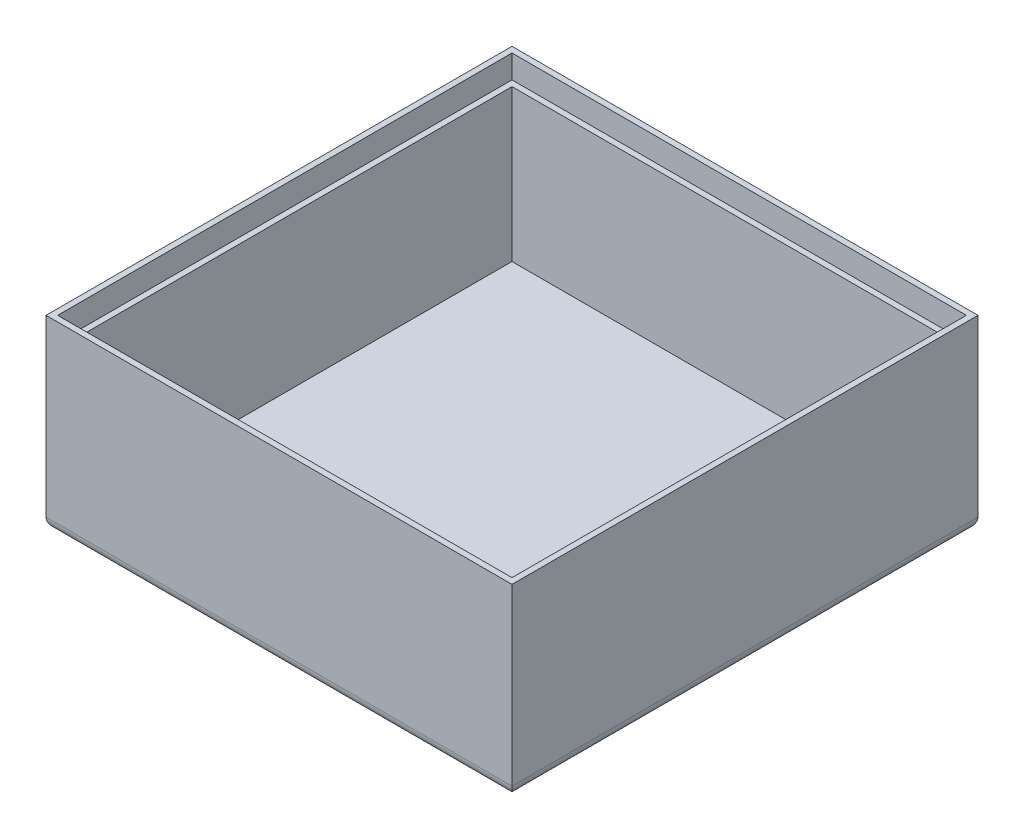
from build123d import *

# Parameters (mm, degrees)
SKETCH_1_W          = 40
SKETCH_1_H          = 40
EXTRUDE_1_DEPTH     = 16
SKETCH_2_W          = 38
SKETCH_2_H          = 38
CUT_EXTRUDE_2_DEPTH = 15
FILLET_2_R          = 1
SKETCH_5_W          = 38
SKETCH_5_H          = 2
CUT_EXTRUDE_4_DEPTH = 0.5
SKETCH_6_W          = 38.5
SKETCH_6_H          = 2
CUT_EXTRUDE_5_DEPTH = 0.5
SKETCH_7_W          = 38.5
SKETCH_7_H          = 2
CUT_EXTRUDE_6_DEPTH = 0.5
SKETCH_8_W          = 39
SKETCH_8_H          = 2
CUT_EXTRUDE_7_DEPTH = 0.5


with BuildPart() as part:
    # Эскиз1 → Бобышка-Вытянуть1 (new body)
    with BuildSketch(Plane(origin=(0, 0, 0), x_dir=(1, 0, 0), z_dir=(0, 1, 0))):
        with Locations((18.915, -19.461)):
            Rectangle(SKETCH_1_W, SKETCH_1_H)
    extrude(amount=EXTRUDE_1_DEPTH)

    # Эскиз2 → Вырез-Вытянуть2 (cut)
    with BuildSketch(Plane(origin=(0, 16, 0), x_dir=(1, 0, 0), z_dir=(0, 1, 0))):
        with Locations((18.915, -19.461)):
            Rectangle(SKETCH_2_W, SKETCH_2_H)
    extrude(amount=-CUT_EXTRUDE_2_DEPTH, mode=Mode.SUBTRACT)

    # Скругление2
    fillet_2_edges = [part.edges().sort_by_distance(p)[0] for p in [
        (18.915, 0, -0.539),
        (38.915, 0, 19.461),
        (18.915, 0, 39.461),
        (-1.085, 0, 19.461),
    ]]
    fillet(fillet_2_edges, radius=FILLET_2_R)

    # Эскиз5 → Вырез-Вытянуть4 (cut)
    with BuildSketch(Plane(origin=(0, 0, 38.461), x_dir=(-1, 0, 0), z_dir=(0, 0, -1))):
        with Locations((-18.915, 15)):
            Rectangle(SKETCH_5_W, SKETCH_5_H)
    extrude(amount=-CUT_EXTRUDE_4_DEPTH, mode=Mode.SUBTRACT)

    # Эскиз6 → Вырез-Вытянуть5 (cut)
    with BuildSketch(Plane(origin=(-0.085, 0, 0), x_dir=(0, 0, -1), z_dir=(1, 0, 0))):
        with Locations((-19.711, 15)):
            Rectangle(SKETCH_6_W, SKETCH_6_H)
    extrude(amount=-CUT_EXTRUDE_5_DEPTH, mode=Mode.SUBTRACT)

    # Эскиз7 → Вырез-Вытянуть6 (cut)
    with BuildSketch(Plane.XY.offset(0.461)):
        with Locations((18.665, 15)):
            Rectangle(SKETCH_7_W, SKETCH_7_H)
    extrude(amount=-CUT_EXTRUDE_6_DEPTH, mode=Mode.SUBTRACT)

    # Эскиз8 → Вырез-Вытянуть7 (cut)
    with BuildSketch(Plane.ZY.offset(-37.915)):
        with Locations((19.461, 15)):
            Rectangle(SKETCH_8_W, SKETCH_8_H)
    extrude(amount=-CUT_EXTRUDE_7_DEPTH, mode=Mode.SUBTRACT)


solid = part.part
